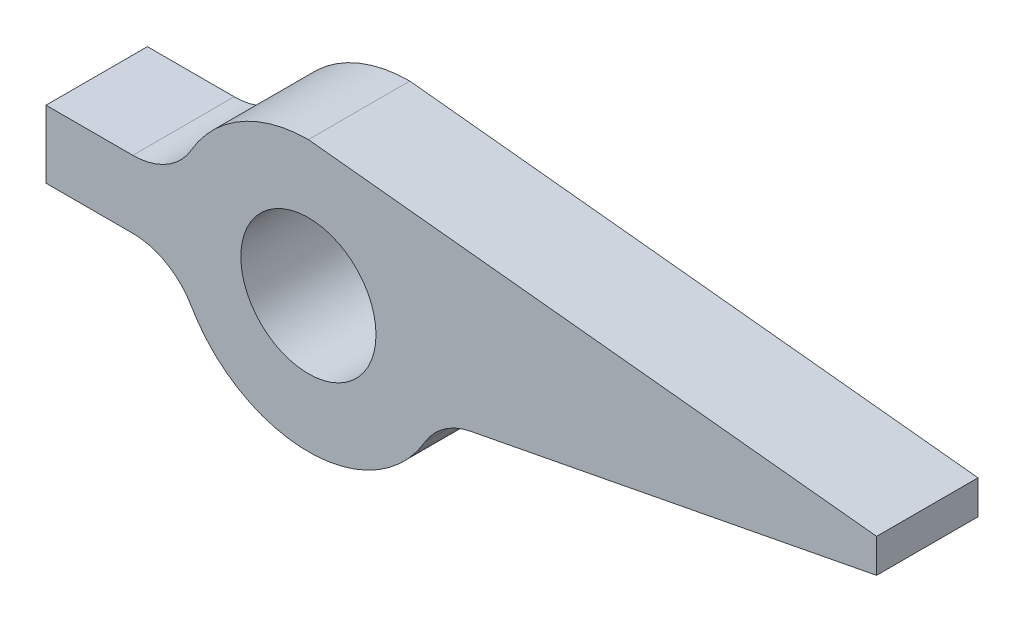
from build123d import *

# Parameters (mm, degrees)
SKETCH1_R           = 1
BOSS_EXTRUDE1_DEPTH = 1.5
FILLET1_R           = 1
FILLET2_R           = 1
FILLET3_R           = 1


with BuildPart() as part:
    # Sketch1 → Boss-Extrude1 (new body)
    with BuildSketch(Plane.XY):
        with BuildLine():
            Line((-2.809934638, 17.270544454), (-2.809934638, 17.770544454))
            Line((-2.809934638, 17.770544454), (-11.216055041, 18.650494389))
            ThreePointArc((-11.216055041, 18.650494389), (-12.440799912, 18.231633219), (-13.152546714, 17.150494389))
            Line((-13.152546714, 17.150494389), (-15.098105849, 17.150494389))
            Line((-15.098105849, 17.150494389), (-15.098105849, 16.150494389))
            Line((-15.098105849, 16.150494389), (-13.152546714, 16.150494389))
            ThreePointArc((-13.152546714, 16.150494389), (-11.28616953, 14.651723777), (-9.319359, 16.016030736))
            Line((-9.319359, 16.016030736), (-2.809934638, 17.270544454))
        make_face()
        with Locations((-11.216055041, 16.650494389)):
            Circle(SKETCH1_R, mode=Mode.SUBTRACT)
    extrude(amount=BOSS_EXTRUDE1_DEPTH)

    # Fillet1
    fillet1_edges = [part.edges().sort_by_distance(p)[0] for p in [
        (-13.152546714, 16.150494389, 0.75),
    ]]
    fillet(fillet1_edges, radius=FILLET1_R)

    # Fillet2
    fillet2_edges = [part.edges().sort_by_distance(p)[0] for p in [
        (-13.152546714, 17.150494389, 0.75),
    ]]
    fillet(fillet2_edges, radius=FILLET2_R)

    # Fillet3
    fillet3_edges = [part.edges().sort_by_distance(p)[0] for p in [
        (-9.319359, 16.016030736, 0.75),
    ]]
    fillet(fillet3_edges, radius=FILLET3_R)


solid = part.part
